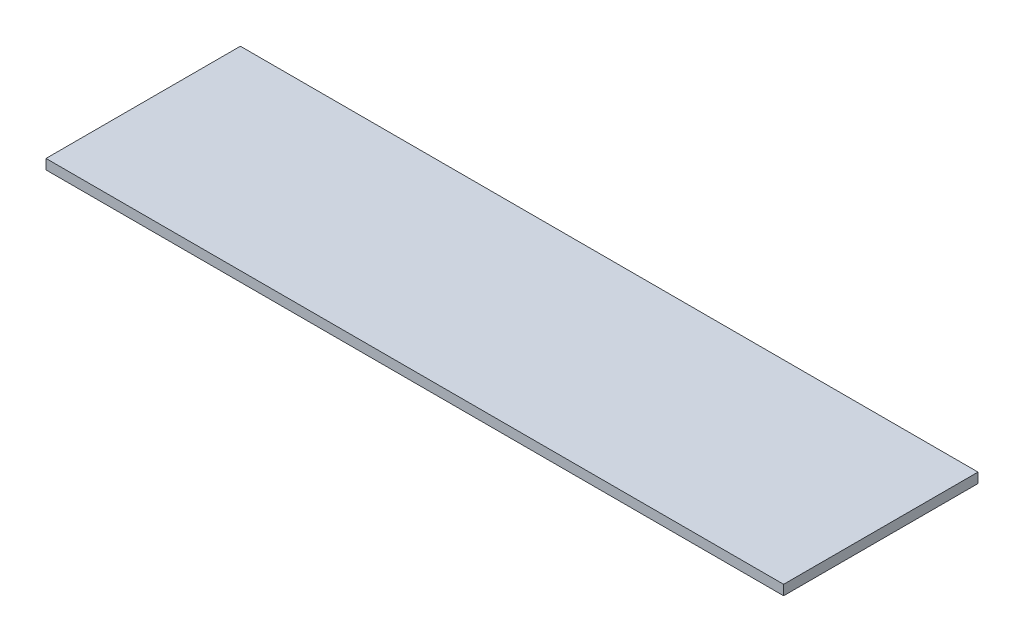
from build123d import *

# Parameters (mm, degrees)
SKETCH1_W           = 469.9
SKETCH1_H           = 123.825
BOSS_EXTRUDE1_DEPTH = 6.35


with BuildPart() as part:
    # Sketch1 → Boss-Extrude1 (new body)
    with BuildSketch(Plane(origin=(0, 0, 0), x_dir=(1, 0, 0), z_dir=(0, 1, 0))):
        with Locations((176.199631458, -40.6793505)):
            Rectangle(SKETCH1_W, SKETCH1_H)
    extrude(amount=-BOSS_EXTRUDE1_DEPTH)


solid = part.part
